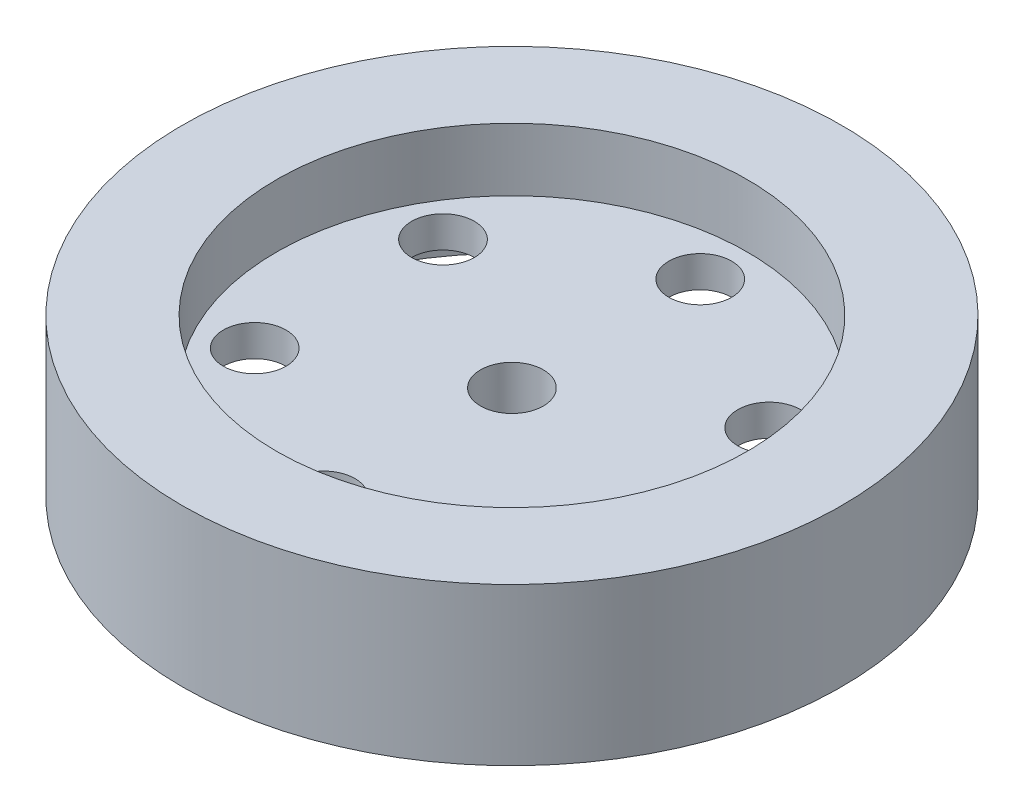
from build123d import *

# Parameters (mm, degrees)
SKETCH1_R           = 21
BOSS_EXTRUDE1_DEPTH = 10
SKETCH2_R           = 15
CUT_EXTRUDE1_DEPTH  = 4
SKETCH3_R           = 19
SKETCH3_R_2         = 5
CUT_EXTRUDE2_DEPTH  = 4
SKETCH4_R           = 2
CUT_EXTRUDE3_DEPTH  = 32.336879232
SKETCH5_R           = 2
CUT_EXTRUDE4_DEPTH  = 31.298514815


with BuildPart() as part:
    # Sketch1 → Boss-Extrude1 (new body)
    with BuildSketch(Plane(origin=(0, 0, 0), x_dir=(1, 0, 0), z_dir=(0, 1, 0))):
        with Locations(Location((0, 0, 0), (0, 0, 270))):
            Circle(SKETCH1_R)
    extrude(amount=BOSS_EXTRUDE1_DEPTH)

    # Sketch2 → Cut-Extrude1 (cut)
    with BuildSketch(Plane(origin=(0, 10, 0), x_dir=(1, 0, 0), z_dir=(0, 1, 0))):
        with Locations(Location((0, 0, 0), (0, 0, 270))):
            Circle(SKETCH2_R)
    extrude(amount=-CUT_EXTRUDE1_DEPTH, mode=Mode.SUBTRACT)

    # Sketch3 → Cut-Extrude2 (cut)
    with BuildSketch(Plane.XZ):
        with Locations(Location((0, 0, 0), (0, 0, 270))):
            Circle(SKETCH3_R)
        with Locations(Location((0, 0, 0), (0, 0, 270))):
            Circle(SKETCH3_R_2, mode=Mode.SUBTRACT)
    extrude(amount=-CUT_EXTRUDE2_DEPTH, mode=Mode.SUBTRACT)

    # Sketch4 → Cut-Extrude3 (cut, through all)
    with BuildSketch(Plane.XZ):
        with Locations(Location((0, 0, 0), (0, 0, 270))):
            Circle(SKETCH4_R)
    extrude(amount=-CUT_EXTRUDE3_DEPTH, mode=Mode.SUBTRACT)

    # Sketch5 → Cut-Extrude4 (cut, through all)
    with BuildSketch(Plane.XZ.offset(-4)):
        with Locations(Location((0, 12, 0), (0, 0, 270))):
            Circle(SKETCH5_R)
        with Locations(Location((10.392304845, 6, 0), (0, 0, 270))):
            Circle(SKETCH5_R)
        with Locations(Location((10.392304845, -6, 0), (0, 0, 270))):
            Circle(SKETCH5_R)
        with Locations(Location((0, -12, 0), (0, 0, 270))):
            Circle(SKETCH5_R)
        with Locations(Location((-10.392304845, -6, 0), (0, 0, 270))):
            Circle(SKETCH5_R)
        with Locations(Location((-10.392304845, 6, 0), (0, 0, 270))):
            Circle(SKETCH5_R)
    extrude(amount=-CUT_EXTRUDE4_DEPTH, mode=Mode.SUBTRACT)


solid = part.part
